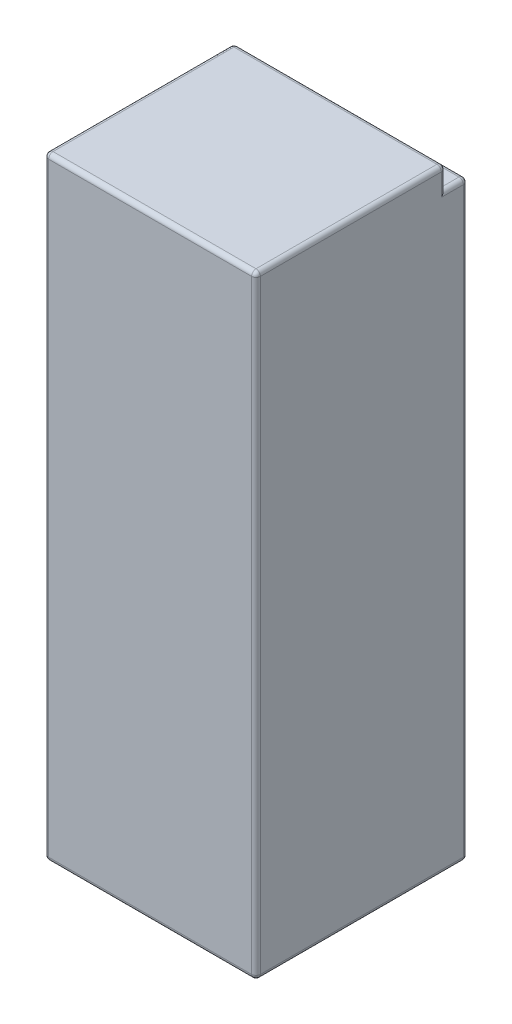
from build123d import *

# Parameters (mm, degrees)
SKETCH1_W               = 48
SKETCH1_H               = 48
BOSS_EXTRUDE1_DEPTH     = 69.5
CUT_EXTRUDE1_DEPTH      = 78.345006303
CUT_EXTRUDE1_DEPTH_BACK = 78.345006303
SKETCH2_W               = 5
SKETCH2_H               = 5
FILLET1_R               = 1


with BuildPart() as part:
    # Sketch1 → Boss-Extrude1 (new, symmetric)
    with BuildSketch(Plane(origin=(0, 0, 0), x_dir=(1, 0, 0), z_dir=(0, 1, 0))):
        Rectangle(SKETCH1_W, SKETCH1_H)
    extrude(amount=BOSS_EXTRUDE1_DEPTH, both=True)

    # Sketch2 → Cut-Extrude1 (cut, two sides: drawn at the far end of the back side and taken through both)
    with BuildSketch(Plane(origin=(0, 0, 0), x_dir=(0, 0, -1), z_dir=(1, 0, 0)).offset(-CUT_EXTRUDE1_DEPTH_BACK)):
        with Locations((21.5, 67)):
            Rectangle(SKETCH2_W, SKETCH2_H)
    extrude(amount=CUT_EXTRUDE1_DEPTH + CUT_EXTRUDE1_DEPTH_BACK, mode=Mode.SUBTRACT)

    # Fillet1
    fillet1_edges = [part.edges().sort_by_distance(p)[0] for p in [
        (24, 69.5, 2.5),
        (-24, 69.5, 2.5),
        (-24, -2.5, -24),
        (24, -2.5, -24),
        (0, 64.5, -24),
        (-24, 64.5, -21.5),
        (-24, 67, -19),
        (0, 69.5, -19),
        (24, 67, -19),
        (24, 64.5, -21.5),
        (0, -69.5, -24),
        (24, -69.5, 0),
        (0, -69.5, 24),
        (-24, -69.5, 0),
        (24, 0, 24),
        (-24, 0, 24),
        (0, 69.5, 24),
    ]]
    fillet(fillet1_edges, radius=FILLET1_R)


solid = part.part
